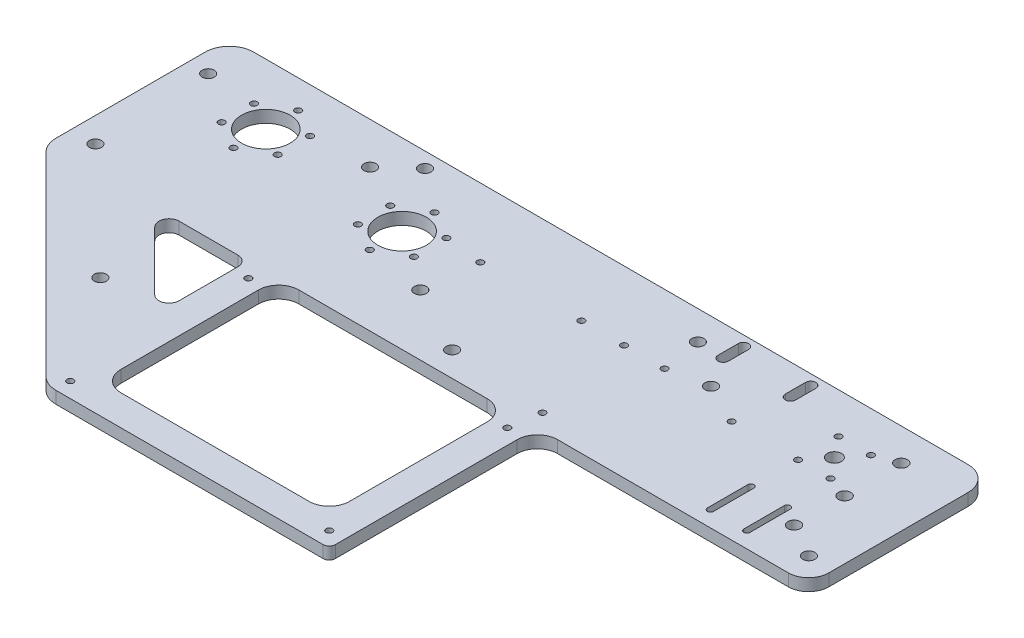
from build123d import *

# Parameters (mm, degrees)
ESBO_O1_R                = 1.6
ESBO_O1_R_2              = 3
ESBO_O1_R_3              = 12
ESBO_O1_R_4              = 3.5
ESBO_O1_R_5              = 3.05
RESSALTO_EXTRUS_O1_DEPTH = 6
ESBO_O2_R                = 3
CORTE_EXTRUS_O1_DEPTH    = 10


with BuildPart() as part:
    # Esboço1 → Ressalto-extrusão1 (new body)
    with BuildSketch(Plane(origin=(0, 0, 0), x_dir=(1, 0, 0), z_dir=(0, 1, 0))):
        with BuildLine():
            Line((-80.557360207, -153.648697641), (51.472077044, -153.648697641))
            ThreePointArc((51.472077044, -153.648697641), (53.593397388, -152.770017984), (54.472077044, -150.648697641))
            Line((54.472077044, -150.648697641), (54.472077044, -60.788592817))
            ThreePointArc((54.472077044, -60.788592817), (57.401009232, -53.717525005), (64.472077044, -50.788592817))
            Line((64.472077044, -50.788592817), (178.527922956, -50.788592817))
            ThreePointArc((178.527922956, -50.788592817), (185.598990768, -47.859660628), (188.527922956, -40.788592817))
            Line((188.527922956, -40.788592817), (188.527922956, 28))
            ThreePointArc((188.527922956, 28), (185.01320433, 36.485281374), (176.527922956, 40))
            Line((176.527922956, 40), (-176.527922956, 40))
            ThreePointArc((-176.527922956, 40), (-185.01320433, 36.485281374), (-188.527922956, 28))
            Line((-188.527922956, 28), (-188.527922956, -45.678134892))
            ThreePointArc((-188.527922956, -45.678134892), (-187.614477346, -50.270336081), (-185.01320433, -54.163416267))
            Line((-185.01320433, -54.163416267), (-89.042641582, -150.133979015))
            ThreePointArc((-89.042641582, -150.133979015), (-85.149561396, -152.735252031), (-80.557360207, -153.648697641))
        make_face()
        with Locations(Location((-81.027922956, -58.148697641, 0), (0, 0, 90))):
            Circle(ESBO_O1_R, mode=Mode.SUBTRACT)
        with Locations(Location((-81.027922956, -146.148697641, 0), (0, 0, 90))):
            Circle(ESBO_O1_R, mode=Mode.SUBTRACT)
        with Locations(Location((46.972077044, -58.148697641, 0), (0, 0, 90))):
            Circle(ESBO_O1_R, mode=Mode.SUBTRACT)
        with Locations(Location((46.972077044, -146.148697641, 0), (0, 0, 90))):
            Circle(ESBO_O1_R, mode=Mode.SUBTRACT)
        with Locations(Location((176.311042956, -38.431817641, 0), (0, 0, 90))):
            Circle(ESBO_O1_R_2, mode=Mode.SUBTRACT)
        with Locations(Location((0, -38.431817641, 0), (0, 0, 90))):
            Circle(ESBO_O1_R_2, mode=Mode.SUBTRACT)
        with Locations(Location((-140.527922956, 10, 0), (0, 0, 90))):
            Circle(ESBO_O1_R_3, mode=Mode.SUBTRACT)
        with Locations(Location((-140.527922956, -6, 0), (0, 0, 270))):
            Circle(ESBO_O1_R, mode=Mode.SUBTRACT)
        with Locations(Location((-154.384329416, 2, 0), (0, 0, 270))):
            Circle(ESBO_O1_R, mode=Mode.SUBTRACT)
        with Locations(Location((-154.384329416, 18, 0), (0, 0, 270))):
            Circle(ESBO_O1_R, mode=Mode.SUBTRACT)
        with Locations(Location((-84.367438628, 32.5, 0), (0, 0, 90))):
            Circle(ESBO_O1_R_2, mode=Mode.SUBTRACT)
        with Locations(Location((-176.311042956, -38.431817641, 0), (0, 0, 90))):
            Circle(ESBO_O1_R_2, mode=Mode.SUBTRACT)
        with Locations(Location((140.527922956, 10, 0), (0, 0, 90))):
            Circle(ESBO_O1_R_4, mode=Mode.SUBTRACT)
        with Locations(Location((148.527922956, 0, 0), (0, 0, 90))):
            Circle(ESBO_O1_R, mode=Mode.SUBTRACT)
        with Locations(Location((148.527922956, 20, 0), (0, 0, 90))):
            Circle(ESBO_O1_R, mode=Mode.SUBTRACT)
        with Locations(Location((132.527922956, 0, 0), (0, 0, 90))):
            Circle(ESBO_O1_R, mode=Mode.SUBTRACT)
        with Locations(Location((132.527922956, 20, 0), (0, 0, 90))):
            Circle(ESBO_O1_R, mode=Mode.SUBTRACT)
        with Locations(Location((-140.527922956, 26, 0), (0, 0, 270))):
            Circle(ESBO_O1_R, mode=Mode.SUBTRACT)
        with Locations(Location((-126.671516495, 18, 0), (0, 0, 270))):
            Circle(ESBO_O1_R, mode=Mode.SUBTRACT)
        with Locations(Location((-126.671516495, 2, 0), (0, 0, 270))):
            Circle(ESBO_O1_R, mode=Mode.SUBTRACT)
        with Locations(Location((-63.17160518, -16, 0), (0, 0, 270))):
            Circle(ESBO_O1_R, mode=Mode.SUBTRACT)
        with Locations(Location((-77.02801164, -8, 0), (0, 0, 270))):
            Circle(ESBO_O1_R, mode=Mode.SUBTRACT)
        with Locations(Location((-77.02801164, 8, 0), (0, 0, 270))):
            Circle(ESBO_O1_R, mode=Mode.SUBTRACT)
        with Locations(Location((-63.17160518, 16, 0), (0, 0, 270))):
            Circle(ESBO_O1_R, mode=Mode.SUBTRACT)
        with Locations(Location((-49.315198719, 8, 0), (0, 0, 270))):
            Circle(ESBO_O1_R, mode=Mode.SUBTRACT)
        with Locations(Location((-49.315198719, -8, 0), (0, 0, 270))):
            Circle(ESBO_O1_R, mode=Mode.SUBTRACT)
        with Locations(Location((-63.17160518, 0, 0), (0, 0, 270))):
            Circle(ESBO_O1_R_3, mode=Mode.SUBTRACT)
        with Locations(Location((-33.527922956, -20.648697641, 0), (0, 0, 270))):
            Circle(ESBO_O1_R_2, mode=Mode.SUBTRACT)
        with Locations(Location((79.527922956, 10, 0), (0, 0, 270))):
            Circle(ESBO_O1_R_2, mode=Mode.SUBTRACT)
        with Locations(Location((99.722077044, 0, 0), (0, 0, 270))):
            Circle(ESBO_O1_R, mode=Mode.SUBTRACT)
        with Locations(Location((49.222077044, -43, 0), (0, 0, 270))):
            Circle(ESBO_O1_R, mode=Mode.SUBTRACT)
        with Locations(Location((-30.527922956, 6, 0), (0, 0, 270))):
            Circle(ESBO_O1_R, mode=Mode.SUBTRACT)
        with Locations(Location((19.472077044, 6, 0), (0, 0, 270))):
            Circle(ESBO_O1_R, mode=Mode.SUBTRACT)
        with Locations(Location((60.527922956, 6, 0), (0, 0, 270))):
            Circle(ESBO_O1_R, mode=Mode.SUBTRACT)
        with Locations(Location((40.527922956, 6, 0), (0, 0, 270))):
            Circle(ESBO_O1_R, mode=Mode.SUBTRACT)
        with Locations(Location((159.467922956, 24.07, 0), (0, 0, 270))):
            Circle(ESBO_O1_R_5, mode=Mode.SUBTRACT)
        with Locations(Location((159.467922956, -3.93, 0), (0, 0, 270))):
            Circle(ESBO_O1_R_5, mode=Mode.SUBTRACT)
        with Locations(Location((159.467922956, -28.93, 0), (0, 0, 270))):
            Circle(ESBO_O1_R_5, mode=Mode.SUBTRACT)
        with Locations(Location((-178.527922956, 19.5, 0), (0, 0, 270))):
            Circle(ESBO_O1_R_2, mode=Mode.SUBTRACT)
        with Locations(Location((-98.527922956, 19.5, 0), (0, 0, 270))):
            Circle(ESBO_O1_R_2, mode=Mode.SUBTRACT)
        with Locations(Location((57.327922956, 25.68, 0), (0, 0, 270))):
            Circle(ESBO_O1_R_2, mode=Mode.SUBTRACT)
        with BuildLine():
            Line((-122.576844598, -50.788592817), (-93.527922956, -50.788592817))
            ThreePointArc((-93.527922956, -50.788592817), (-89.99238905, -52.253058911), (-88.527922956, -55.788592817))
            Line((-88.527922956, -55.788592817), (-88.527922956, -84.837514459))
            ThreePointArc((-88.527922956, -84.837514459), (-91.614505794, -89.456912121), (-97.063456862, -88.373048365))
            Line((-97.063456862, -88.373048365), (-126.112378504, -59.324126723))
            ThreePointArc((-126.112378504, -59.324126723), (-127.196242261, -53.875175655), (-122.576844598, -50.788592817))
        make_face(mode=Mode.SUBTRACT)
        with BuildLine():
            Line((39.472077044, -60.648697641), (39.472077044, -128.648697641))
            ThreePointArc((39.472077044, -128.648697641), (36.543144856, -135.719765453), (29.472077044, -138.648697641))
            Line((29.472077044, -138.648697641), (-63.527922956, -138.648697641))
            ThreePointArc((-63.527922956, -138.648697641), (-70.598990768, -135.719765453), (-73.527922956, -128.648697641))
            Line((-73.527922956, -128.648697641), (-73.527922956, -60.648697641))
            ThreePointArc((-73.527922956, -60.648697641), (-70.598990768, -53.577629829), (-63.527922956, -50.648697641))
            Line((-63.527922956, -50.648697641), (29.472077044, -50.648697641))
            ThreePointArc((29.472077044, -50.648697641), (36.543144856, -53.577629829), (39.472077044, -60.648697641))
        make_face(mode=Mode.SUBTRACT)
        with BuildLine():
            Line((148.722077044, -43), (148.722077044, -23))
            ThreePointArc((148.722077044, -23), (150.222077044, -21.5), (151.722077044, -23))
            Line((151.722077044, -23), (151.722077044, -43))
            ThreePointArc((151.722077044, -43), (150.222077044, -44.5), (148.722077044, -43))
        make_face(mode=Mode.SUBTRACT)
        with BuildLine():
            Line((133.722077044, -43), (133.722077044, -23))
            ThreePointArc((133.722077044, -23), (132.222077044, -21.5), (130.722077044, -23))
            Line((130.722077044, -23), (130.722077044, -43))
            ThreePointArc((130.722077044, -43), (132.222077044, -44.5), (133.722077044, -43))
        make_face(mode=Mode.SUBTRACT)
        with BuildLine():
            Line((67.977922956, 25), (67.977922956, 35))
            ThreePointArc((67.977922956, 35), (70.527922956, 37.55), (73.077922956, 35))
            Line((73.077922956, 35), (73.077922956, 25))
            ThreePointArc((73.077922956, 25), (70.527922956, 22.45), (67.977922956, 25))
        make_face(mode=Mode.SUBTRACT)
        with BuildLine():
            Line((101.227922956, 25), (101.227922956, 35))
            ThreePointArc((101.227922956, 35), (103.777922956, 37.55), (106.327922956, 35))
            Line((106.327922956, 35), (106.327922956, 25))
            ThreePointArc((106.327922956, 25), (103.777922956, 22.45), (101.227922956, 25))
        make_face(mode=Mode.SUBTRACT)
    extrude(amount=-RESSALTO_EXTRUS_O1_DEPTH)

    # Esboço2 → Corte-extrusão1 (cut)
    with BuildSketch(Plane(origin=(0, 0, 0), x_dir=(1, 0, 0), z_dir=(0, 1, 0))):
        with Locations(Location((-117.838060117, -94.468502794, 0), (0, 0, 270))):
            Circle(ESBO_O2_R)
    extrude(amount=-CORTE_EXTRUS_O1_DEPTH, mode=Mode.SUBTRACT)


solid = part.part
